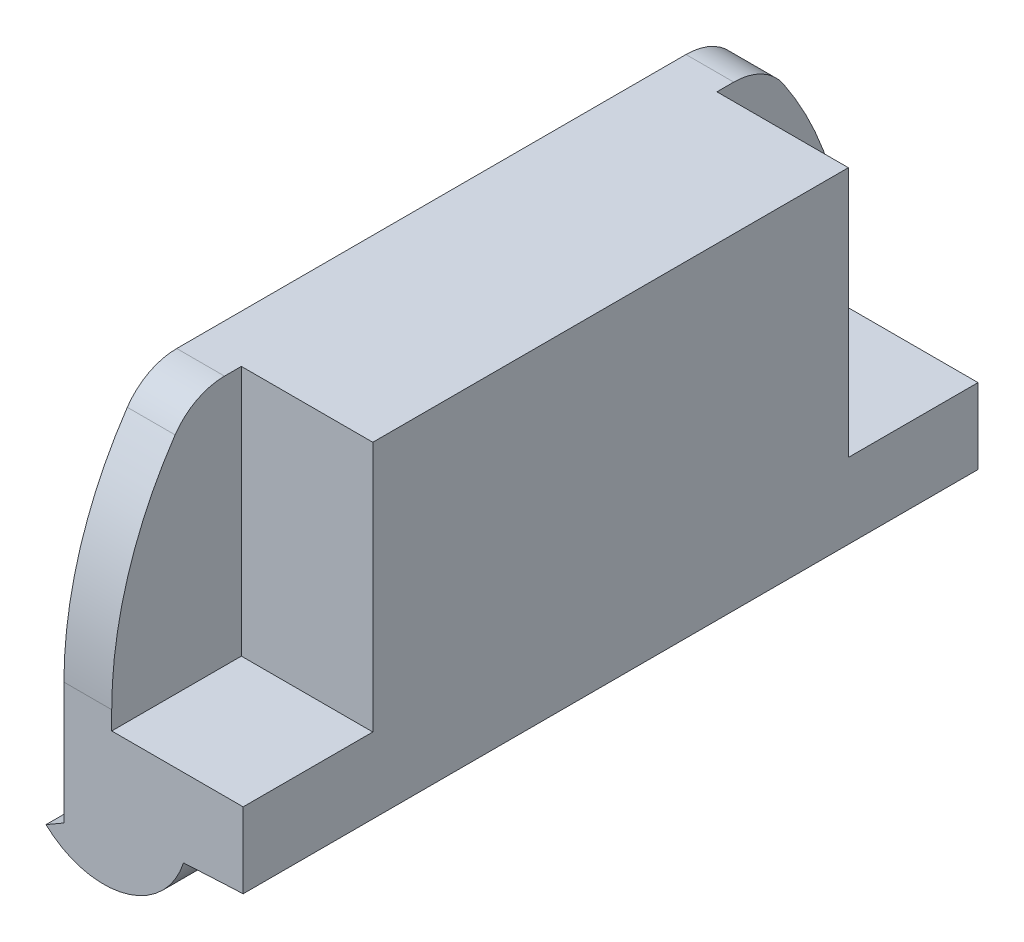
from build123d import *

# Parameters (mm, degrees)
BOSS_EXTRUDE1_DEPTH = 12.3
SKETCH2_W           = 2.2
SKETCH2_H           = 2.17
CUT_EXTRUDE1_DEPTH  = 4.2
CUT_EXTRUDE3_DEPTH  = 0.8
SKETCH5_W           = 3
SKETCH5_H           = 1
BOSS_EXTRUDE2_DEPTH = 0.4
BOSS_EXTRUDE3_DEPTH = 3


with BuildPart() as part:
    # Sketch1 → Boss-Extrude1 (new body)
    with BuildSketch(Plane.XY):
        with BuildLine():
            Line((0, 0), (0.299997713, 0.173208719))
            Line((0.299997713, 0.173208719), (0.299997713, 1.781598719))
            Line((0.299997713, 1.781598719), (0.299997713, 6.107458719))
            Line((0.299997713, 6.107458719), (3.299997713, 6.107458719))
            Line((3.299997713, 6.107458719), (3.299997713, 0.646828719))
            ThreePointArc((3.299997713, 0.646828719), (2.80057856, 0.622710158), (2.301269667, 0.596407591))
            ThreePointArc((2.301269667, 0.596407591), (1.315500673, -0.337939607), (0, 0))
        make_face()
    extrude(amount=BOSS_EXTRUDE1_DEPTH)

    # Sketch2 → Cut-Extrude1 (cut)
    with BuildSketch(Plane(origin=(0, 6.107458719, 0), x_dir=(1, 0, 0), z_dir=(0, 1, 0))):
        with Locations((2.199997713, -1.085)):
            Rectangle(SKETCH2_W, SKETCH2_H)
        with Locations((2.199997713, -11.215)):
            Rectangle(SKETCH2_W, SKETCH2_H)
    extrude(amount=-CUT_EXTRUDE1_DEPTH, mode=Mode.SUBTRACT)

    # Sketch4 → Cut-Extrude3 (cut)
    with BuildSketch(Plane.ZY.offset(-0.299997713)):
        with BuildLine():
            Line((10.41158, 6.107458719), (12.3, 6.107458719))
            Line((12.3, 6.107458719), (12.3, 2.215929667))
            ThreePointArc((12.3, 2.215929667), (12.02880398, 4.022129667), (11.23913234, 5.669043272))
            ThreePointArc((11.23913234, 5.669043272), (10.879869522, 5.991150317), (10.41158, 6.107458719))
        make_face()
        with BuildLine():
            Line((1.88842, 6.107458719), (0, 6.107458719))
            Line((0, 6.107458719), (0, 2.215929667))
            ThreePointArc((0, 2.215929667), (0.27119602, 4.022129667), (1.06086766, 5.669043272))
            ThreePointArc((1.06086766, 5.669043272), (1.420130478, 5.991150317), (1.88842, 6.107458719))
        make_face()
    extrude(amount=-CUT_EXTRUDE3_DEPTH, mode=Mode.SUBTRACT)

    # Sketch5 → Boss-Extrude2 (add)
    with BuildSketch(Plane.ZY.offset(-0.299997713)):
        with Locations((6.15, 2.281598719)):
            Rectangle(SKETCH5_W, SKETCH5_H)
    extrude(amount=BOSS_EXTRUDE2_DEPTH)

    # Sketch6 → Boss-Extrude3 (add)
    with BuildSketch(Plane.XY.offset(7.65)):
        Polygon((0.299997713, 2.781598719), (0.299997713, 4.373208719), (-0.100002287, 2.781598719), align=None)
    extrude(amount=-BOSS_EXTRUDE3_DEPTH)


solid = part.part
